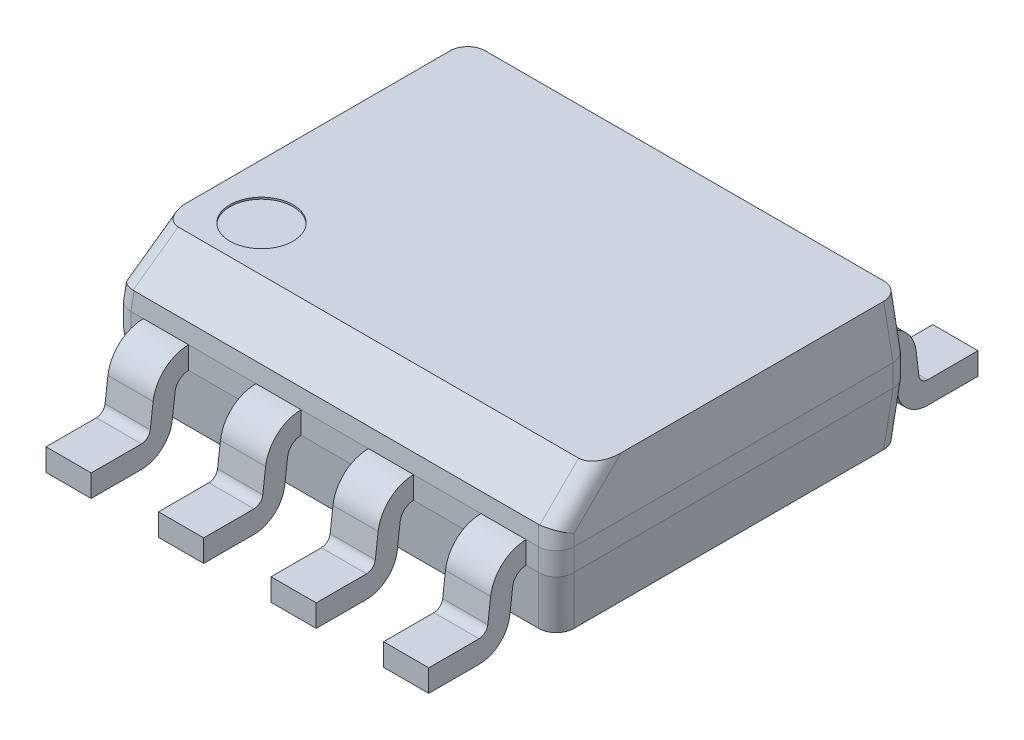
from build123d import *

# Parameters (mm, degrees)
BOSS_EXTRUDE1_DEPTH      = 0.125
BOSS_EXTRUDE1_DEPTH_BACK = 0.125
SKETCH1_W                = 5
SKETCH1_H                = 4
SKETCH2_W                = 5
SKETCH2_H                = 4
BOSS_EXTRUDE2_DEPTH      = 0.6
BOSS_EXTRUDE2_TAPER      = 5
SKETCH3_W                = 5
SKETCH3_H                = 4
BOSS_EXTRUDE3_DEPTH      = 0.6
BOSS_EXTRUDE3_TAPER      = 5
CHAMFER1_SIZE            = 0.4
CHAMFER1_SIZE2           = 0.440025147
BOSS_EXTRUDE4_START      = 0.38
BOSS_EXTRUDE4_DEPTH      = 0.51
LPATTERN1_COUNT          = 2
LPATTERN1_PITCH          = 1.27
LPATTERN1_COL_COUNT      = 3
LPATTERN1_COL_PITCH      = 1.27
SKETCH6_R                = 0.356697025
CUT_EXTRUDE1_DEPTH       = 0.02
FILLET_1_R               = 0.2
CUT_EXTRUDE2_DEPTH       = 0.01


with BuildPart() as part:
    # Sketch1 → Boss-Extrude1 (new, two sides: drawn at the far end of the back side and taken through both)
    with BuildSketch(Plane(origin=(0, 0.82, 0), x_dir=(1, 0, 0), z_dir=(0, 1, 0)).offset(-BOSS_EXTRUDE1_DEPTH_BACK)):
        Rectangle(SKETCH1_W, SKETCH1_H)
    extrude(amount=BOSS_EXTRUDE1_DEPTH + BOSS_EXTRUDE1_DEPTH_BACK)

    # Sketch2 → Boss-Extrude2 (add)
    with BuildSketch(Plane(origin=(0, 0.945, 0), x_dir=(1, 0, 0), z_dir=(0, 1, 0))):
        Rectangle(SKETCH2_W, SKETCH2_H)
    extrude(amount=BOSS_EXTRUDE2_DEPTH, taper=BOSS_EXTRUDE2_TAPER)

    # Sketch3 → Boss-Extrude3 (add)
    with BuildSketch(Plane.XZ.offset(-0.695)):
        Rectangle(SKETCH3_W, SKETCH3_H)
    extrude(amount=BOSS_EXTRUDE3_DEPTH, taper=BOSS_EXTRUDE3_TAPER)

    # Chamfer1
    chamfer1_edges = [part.edges().sort_by_distance(p)[0] for p in [
        (0, 1.545, 1.947506802),
    ]]
    chamfer1_side = [part.faces().sort_by_distance(p)[0] for p in [
        (0, 1.243938997, 1.973846227),
    ]]
    chamfer(chamfer1_edges, length=CHAMFER1_SIZE, length2=CHAMFER1_SIZE2, reference=chamfer1_side[0])

    # Sketch5 → Boss-Extrude4 (add)
    with BuildSketch(Plane(origin=(0, 0, 0), x_dir=(0, 0, -1), z_dir=(1, 0, 0)).offset(BOSS_EXTRUDE4_START)):
        with BuildLine():
            Line((2.43285762, 0.329963507), (2.400847843, 0.590403282))
            ThreePointArc((2.400847843, 0.590403282), (2.267590241, 0.843628667), (2, 0.945))
            Line((2, 0.945), (2, 0.695))
            ThreePointArc((2, 0.695), (2.101946488, 0.656379776), (2.152714971, 0.559906105))
            Line((2.152714971, 0.559906105), (2.184724748, 0.299466331))
            ThreePointArc((2.184724748, 0.299466331), (2.300209515, 0.080013931), (2.532110769, -0.007837622))
            Line((2.532110769, -0.007837622), (3.099630301, -0.007837622))
            Line((3.099630301, -0.007837622), (3.099630301, 0.242162378))
            Line((3.099630301, 0.242162378), (2.532110769, 0.242162378))
            ThreePointArc((2.532110769, 0.242162378), (2.465853268, 0.267262822), (2.43285762, 0.329963507))
        make_face()
        with BuildLine():
            ThreePointArc((-2.152714971, 0.559906105), (-2.101946488, 0.656379776), (-2, 0.695))
            Line((-2, 0.695), (-2, 0.945))
            ThreePointArc((-2, 0.945), (-2.267590241, 0.843628667), (-2.400847843, 0.590403282))
            Line((-2.400847843, 0.590403282), (-2.43285762, 0.329963507))
            ThreePointArc((-2.43285762, 0.329963507), (-2.465853268, 0.267262822), (-2.532110769, 0.242162378))
            Line((-2.532110769, 0.242162378), (-3.099630301, 0.242162378))
            Line((-3.099630301, 0.242162378), (-3.099630301, -0.007837622))
            Line((-3.099630301, -0.007837622), (-2.532110769, -0.007837622))
            ThreePointArc((-2.532110769, -0.007837622), (-2.300209515, 0.080013931), (-2.184724748, 0.299466331))
            Line((-2.184724748, 0.299466331), (-2.152714971, 0.559906105))
        make_face()
    boss_extrude4 = extrude(amount=BOSS_EXTRUDE4_DEPTH)

    # LPattern1: Boss-Extrude4 ×2
    with Locations(*[(i * LPATTERN1_PITCH, 0, 0) for i in range(1, LPATTERN1_COUNT)]):
        add(boss_extrude4)

    # LPattern1 col: Boss-Extrude4 ×3
    with Locations(*[(-i * LPATTERN1_COL_PITCH, 0, 0) for i in range(1, LPATTERN1_COL_COUNT)]):
        add(boss_extrude4)

    # Sketch6 → Cut-Extrude1 (cut)
    with BuildSketch(Plane(origin=(0, 1.545, 0), x_dir=(1, 0, 0), z_dir=(0, 1, 0))):
        with Locations(Location((-1.829466097, -0.997890598, 0), (0, 0, 270))):
            Circle(SKETCH6_R)
    extrude(amount=-CUT_EXTRUDE1_DEPTH, mode=Mode.SUBTRACT)

    # Скругление1
    fillet_1_edges = [part.edges().sort_by_distance(p)[0] for p in [
        (-2.33, 0.945, 2),
        (2.33, 0.695, -2),
        (2.33, 0.945, -2),
        (2.473753401, 1.245, -1.973753401),
        (-2.473753401, 1.245, -1.973753401),
        (2.473753401, 0.395, 1.973753401),
        (-2.473753401, 0.395, 1.973753401),
        (-2.473753401, 0.395, -1.973753401),
        (2.473753401, 0.395, -1.973753401),
        (2.491184549, 1.04576106, 1.991184549),
        (2.46493795, 1.34576106, 1.744925377),
        (-2.491184549, 1.04576106, 1.991184549),
        (-2.46493795, 1.34576106, 1.744925377),
        (-2.33, 0.695, 2),
        (-2.5, 0.82, -2),
        (2.5, 0.82, -2),
        (2.5, 0.82, 2),
        (-2.5, 0.82, 2),
    ]]
    fillet(fillet_1_edges, radius=FILLET_1_R)

    # Sketch7 → Cut-Extrude2 (cut)
    # profile 1 of 3: a face of its own
    with BuildSketch(Plane(origin=(0, 1.745, 0), x_dir=(1, 0, 0), z_dir=(0, 1, 0))):
        with BuildLine():
            Line((-1.226287299, -0.23455359), (-1.141752043, -0.1838725))
            add(Edge.make_bspline(
                [(-1.141752043, -0.1838725), (-1.133889689, -0.197033753), (-1.118825723, -0.222250206), (-1.093696763, -0.256323932), (-1.067658789, -0.285284548), (-1.040518979, -0.308963579), (-1.012442994, -0.327606118), (-0.98324755, -0.340806755), (-0.953031033, -0.349039891), (-0.932467084, -0.350039916), (-0.92220076, -0.350539167)],
                knots=[0, 0, 0, 0, 1.272034388, 2.437168799, 3.508375237, 4.49857839, 5.41946034, 6.295179144, 7.148887113, 8, 8, 8, 8], degree=3))
            add(Edge.make_bspline(
                [(-0.92220076, -0.350539167), (-0.913433086, -0.350294975), (-0.896051151, -0.349810863), (-0.870461939, -0.345159206), (-0.845609995, -0.338012883), (-0.822007527, -0.327778331), (-0.799980209, -0.315395907), (-0.78066401, -0.300439856), (-0.763965121, -0.283695226), (-0.750305374, -0.265014467), (-0.739825363, -0.244923854), (-0.731770487, -0.224302153), (-0.727300466, -0.202825419), (-0.726627108, -0.188365287), (-0.726287299, -0.181068013)],
                knots=[0, 0, 0, 0, 1.095163259, 2.171163733, 3.241058638, 4.321873601, 5.38011039, 6.391990106, 7.366004449, 8.327778327, 9.272591725, 10.192022065, 11.087607919, 12, 12, 12, 12], degree=3))
            add(Edge.make_bspline(
                [(-0.726287299, -0.181068013), (-0.726708531, -0.172742056), (-0.727564833, -0.155816602), (-0.734802399, -0.130845273), (-0.746187898, -0.10613311), (-0.75669151, -0.090847034), (-0.762144671, -0.082910962)],
                knots=[0, 0, 0, 0, 0.938893495, 1.908633276, 2.914225137, 4, 4, 4, 4], degree=3))
            add(Edge.make_bspline(
                [(-0.762144671, -0.082910962), (-0.766621989, -0.077183298), (-0.776021559, -0.065158784), (-0.792180848, -0.047260145), (-0.811142595, -0.02879774), (-0.832257897, -0.009066581), (-0.856295922, 0.011015647), (-0.882503783, 0.032406583), (-0.9115506, 0.054292748), (-0.931921885, 0.068970624), (-0.942433132, 0.076544166)],
                knots=[0, 0, 0, 0, 0.722233717, 1.516239348, 2.393582979, 3.351407094, 4.387010283, 5.505090956, 6.712668013, 8, 8, 8, 8], degree=3))
            add(Edge.make_bspline(
                [(-0.942433132, 0.076544166), (-0.952954274, 0.084038048), (-0.973069896, 0.098365781), (-1.001200919, 0.119629862), (-1.02635648, 0.139070967), (-1.048424771, 0.156872114), (-1.067396084, 0.173035715), (-1.083419916, 0.187406555), (-1.096088075, 0.200373286), (-1.103132527, 0.208785098), (-1.106295312, 0.212561794)],
                knots=[0, 0, 0, 0, 1.452282411, 2.77665338, 3.964542531, 5.026858415, 5.96415736, 6.766646006, 7.446254459, 8, 8, 8, 8], degree=3))
            add(Edge.make_bspline(
                [(-1.106295312, 0.212561794), (-1.110716039, 0.218447805), (-1.119409992, 0.230023435), (-1.130885994, 0.248116251), (-1.14064004, 0.266637184), (-1.148286421, 0.285636003), (-1.154725341, 0.304845982), (-1.159056178, 0.324517767), (-1.161768006, 0.344563086), (-1.162045716, 0.358052658), (-1.162184735, 0.364805384)],
                knots=[0, 0, 0, 0, 1.068054152, 2.10047183, 3.106115577, 4.101338837, 5.06977816, 6.043150881, 7.020423561, 8, 8, 8, 8], degree=3))
            add(Edge.make_bspline(
                [(-1.162184735, 0.364805384), (-1.161811818, 0.37538532), (-1.161073955, 0.396319052), (-1.154833807, 0.42689929), (-1.144984409, 0.456095409), (-1.13118587, 0.483618361), (-1.113398055, 0.508751499), (-1.092813491, 0.531783924), (-1.068295923, 0.551146376), (-1.041395174, 0.568064107), (-1.011950496, 0.581305799), (-0.981095952, 0.591294651), (-0.948782503, 0.596954439), (-0.926895893, 0.597766657), (-0.915790504, 0.598178782)],
                knots=[0, 0, 0, 0, 1.005424448, 1.989358655, 2.955360095, 3.929531133, 4.905563448, 5.876582895, 6.856512386, 7.866279853, 8.892233794, 9.918561126, 10.94386622, 12, 12, 12, 12], degree=3))
            add(Edge.make_bspline(
                [(-0.915790504, 0.598178782), (-0.904006475, 0.597772338), (-0.880571803, 0.596964052), (-0.846100599, 0.589936186), (-0.812911823, 0.578307423), (-0.786213747, 0.565110663), (-0.765318673, 0.551930259), (-0.749383606, 0.539924595), (-0.733235763, 0.526103135), (-0.71674489, 0.510429065), (-0.700190416, 0.492758565), (-0.683326573, 0.473212654), (-0.666113924, 0.45191078), (-0.655040821, 0.43670378), (-0.649364222, 0.428907948)],
                knots=[0, 0, 0, 0, 1.286793592, 2.559021753, 3.825965368, 5.121522368, 5.803751409, 6.523245864, 7.299691795, 8.125521123, 9.008227632, 9.944561021, 10.946284179, 12, 12, 12, 12], degree=3))
            Line((-0.649364222, 0.428907948), (-0.73049403, 0.367409551))
            add(Edge.make_bspline(
                [(-0.73049403, 0.367409551), (-0.735392868, 0.373720605), (-0.744826884, 0.38587422), (-0.759149594, 0.402894596), (-0.772649208, 0.418442162), (-0.785949322, 0.431946484), (-0.798347503, 0.444147094), (-0.810380943, 0.454592739), (-0.821876472, 0.463385766), (-0.836367018, 0.47276964), (-0.854572081, 0.482071498), (-0.877424805, 0.489942663), (-0.901306598, 0.494672681), (-0.917572207, 0.495298078), (-0.92580653, 0.495614679)],
                knots=[0, 0, 0, 0, 1.181633172, 2.275549214, 3.290209073, 4.226197932, 5.078386478, 5.862611352, 6.581680152, 7.217281963, 8.414376989, 9.595101626, 10.782541182, 12, 12, 12, 12], degree=3))
            add(Edge.make_bspline(
                [(-0.92580653, 0.495614679), (-0.936136965, 0.495268479), (-0.956058235, 0.494600865), (-0.98434116, 0.487309441), (-1.009796567, 0.475828909), (-1.031668729, 0.459738915), (-1.049879293, 0.440675775), (-1.063052282, 0.418738959), (-1.0709809, 0.394515415), (-1.071948409, 0.377617799), (-1.072441145, 0.369012115)],
                knots=[0, 0, 0, 0, 1.14458467, 2.207223713, 3.21896685, 4.227309161, 5.202851033, 6.127160689, 7.046193047, 8, 8, 8, 8], degree=3))
            add(Edge.make_bspline(
                [(-1.072441145, 0.369012115), (-1.072328823, 0.36365455), (-1.072103996, 0.352930658), (-1.068968339, 0.337087395), (-1.06493996, 0.321284155), (-1.05855635, 0.305591989), (-1.049743407, 0.289736457), (-1.038170499, 0.273444532), (-1.023595267, 0.256572616), (-1.012430406, 0.24559908), (-1.006535696, 0.239805384)],
                knots=[0, 0, 0, 0, 0.858281714, 1.717966888, 2.583508476, 3.4729293, 4.427298488, 5.488583878, 6.674047936, 8, 8, 8, 8], degree=3))
            add(Edge.make_bspline(
                [(-1.006535696, 0.239805384), (-1.004346733, 0.237851948), (-0.999146256, 0.233211032), (-0.989638849, 0.225613237), (-0.977083764, 0.216241016), (-0.961808849, 0.20464464), (-0.94353246, 0.191192794), (-0.922252587, 0.176057476), (-0.898206435, 0.158747345), (-0.88114303, 0.146645191), (-0.872120632, 0.140246089)],
                knots=[0, 0, 0, 0, 0.420754252, 0.999615792, 1.744751191, 2.668019286, 3.750313428, 4.999500688, 6.413464383, 8, 8, 8, 8], degree=3))
            add(Edge.make_bspline(
                [(-0.872120632, 0.140246089), (-0.861267514, 0.132348558), (-0.840251955, 0.117056083), (-0.81034979, 0.094080175), (-0.783237273, 0.071609384), (-0.758819215, 0.04978721), (-0.736854384, 0.028779184), (-0.717586464, 0.008332561), (-0.700819126, -0.011406174), (-0.682767921, -0.036712625), (-0.66432283, -0.067792934), (-0.648482399, -0.105872431), (-0.6384943, -0.144099951), (-0.637188153, -0.169793333), (-0.636543709, -0.182470257)],
                knots=[0, 0, 0, 0, 1.163667725, 2.253281268, 3.268753668, 4.215851969, 5.092017293, 5.902905408, 6.650798638, 7.335211899, 8.59617414, 9.77448103, 10.901945474, 12, 12, 12, 12], degree=3))
            add(Edge.make_bspline(
                [(-0.636543709, -0.182470257), (-0.636731463, -0.191435504), (-0.637103324, -0.209191899), (-0.641377871, -0.235264778), (-0.647640633, -0.260587884), (-0.657079842, -0.284848202), (-0.668600745, -0.308489563), (-0.683219673, -0.33089182), (-0.700164725, -0.352550791), (-0.719602944, -0.372888931), (-0.740873202, -0.391559273), (-0.763354257, -0.408167576), (-0.787082907, -0.422015669), (-0.811930426, -0.433315909), (-0.837902522, -0.442154057), (-0.86499046, -0.448557734), (-0.893238892, -0.452487937), (-0.91243903, -0.452895869), (-0.92220076, -0.45310327)],
                knots=[0, 0, 0, 0, 0.983748083, 1.948392443, 2.894712957, 3.844097841, 4.80183111, 5.778335162, 6.776009319, 7.81870978, 8.863265674, 9.881300176, 10.883814829, 11.87499822, 12.874611388, 13.892143829, 14.928324115, 16, 16, 16, 16], degree=3))
            add(Edge.make_bspline(
                [(-0.92220076, -0.45310327), (-0.929753716, -0.452957218), (-0.944764504, -0.452666953), (-0.966967213, -0.450100873), (-0.988721382, -0.446470272), (-1.009754034, -0.440706252), (-1.030336151, -0.43371283), (-1.050378218, -0.425101878), (-1.069889948, -0.414782678), (-1.088980686, -0.402984099), (-1.107601879, -0.389253315), (-1.125578869, -0.373260887), (-1.143501494, -0.355447886), (-1.16084075, -0.335330582), (-1.177947363, -0.313233987), (-1.194484051, -0.288951363), (-1.210793113, -0.262614976), (-1.221026104, -0.244082095), (-1.226287299, -0.23455359)],
                knots=[0, 0, 0, 0, 0.915332311, 1.819136955, 2.706846663, 3.586547465, 4.459518054, 5.340707479, 6.227863349, 7.133153174, 8.059268498, 9.028702269, 10.047606654, 11.120612155, 12.245963614, 13.433783089, 14.680604001, 16, 16, 16, 16], degree=3))
        make_face()
    # profile 2 of 3: a face of its own
    with BuildSketch(Plane(origin=(0, 1.745, 0), x_dir=(1, 0, 0), z_dir=(0, 1, 0))):
        with BuildLine():
            add(Edge.make_bspline(
                [(0.036533214, 0.598178782), (0.055049816, 0.597709788), (0.091417949, 0.596788644), (0.14486792, 0.589737472), (0.19589509, 0.577538789), (0.24491513, 0.561292223), (0.291341694, 0.539619541), (0.335524235, 0.513423784), (0.377357627, 0.482430511), (0.416278022, 0.446879303), (0.451894294, 0.408198316), (0.483273118, 0.366918913), (0.509570917, 0.323290684), (0.531166856, 0.277444732), (0.548109316, 0.229484741), (0.559800471, 0.179155026), (0.567268514, 0.126781686), (0.568141593, 0.091059725), (0.568584496, 0.072938397)],
                knots=[0, 0, 0, 0, 1.065120563, 2.091984664, 3.0946048, 4.079830382, 5.057816894, 6.036188127, 7.030412546, 8.04752943, 9.064399622, 10.05169764, 11.02544977, 11.989514704, 12.962713494, 13.945757189, 14.957906945, 16, 16, 16, 16], degree=3))
            add(Edge.make_bspline(
                [(0.568584496, 0.072938397), (0.568141658, 0.054950555), (0.567268773, 0.019494435), (0.55979198, -0.032546549), (0.54806598, -0.082572462), (0.531324189, -0.130499792), (0.509831196, -0.176379096), (0.48335829, -0.220089654), (0.452175086, -0.261645796), (0.416687415, -0.300592272), (0.378001403, -0.336305835), (0.336507041, -0.367425514), (0.293137521, -0.394203835), (0.247334747, -0.415570599), (0.199706165, -0.432648291), (0.149825501, -0.444291899), (0.097926486, -0.451802483), (0.062534771, -0.452664916), (0.044546034, -0.45310327)],
                knots=[0, 0, 0, 0, 1.043624062, 2.057103931, 3.04512605, 4.022047818, 4.998200453, 5.980619268, 6.982898556, 8.009068085, 9.034988726, 10.034168286, 11.015286542, 11.987931943, 12.962482838, 13.94673481, 14.956375938, 16, 16, 16, 16], degree=3))
            add(Edge.make_bspline(
                [(0.044546034, -0.45310327), (0.0264248, -0.452660588), (-0.009296976, -0.451787944), (-0.061736129, -0.444307542), (-0.112101198, -0.432610027), (-0.160248156, -0.415893045), (-0.20620385, -0.394288122), (-0.250058159, -0.367944014), (-0.291635058, -0.336684831), (-0.330589843, -0.301208666), (-0.366232471, -0.262588223), (-0.397306579, -0.221207007), (-0.423656611, -0.177876877), (-0.445188992, -0.132477584), (-0.46223598, -0.085228601), (-0.473865928, -0.03581475), (-0.481390486, 0.015482252), (-0.482257585, 0.050408794), (-0.482697555, 0.068130705)],
                knots=[0, 0, 0, 0, 1.053102029, 2.075944431, 3.073151272, 4.055350789, 5.033113405, 6.020478099, 7.024410459, 8.052272461, 9.079885166, 10.07527673, 11.055994387, 12.023226415, 12.992069828, 13.970394897, 14.97016774, 16, 16, 16, 16], degree=3))
            add(Edge.make_bspline(
                [(-0.482697555, 0.068130705), (-0.482544802, 0.080025753), (-0.482241223, 0.103665788), (-0.478586454, 0.138770531), (-0.473283111, 0.173310719), (-0.465682564, 0.207188133), (-0.455742088, 0.240319843), (-0.444012937, 0.272934346), (-0.429687267, 0.304701125), (-0.413492797, 0.335770665), (-0.395417994, 0.365658638), (-0.375453494, 0.393909948), (-0.354300532, 0.420761661), (-0.331110991, 0.445517948), (-0.306649149, 0.468898993), (-0.280518184, 0.490545483), (-0.252877543, 0.510652612), (-0.223608292, 0.528772709), (-0.193431642, 0.545161034), (-0.162323991, 0.55922442), (-0.130707828, 0.571294723), (-0.098435071, 0.581077816), (-0.065591422, 0.588801255), (-0.032105198, 0.594060499), (0.001996924, 0.597724589), (0.024971587, 0.598026733), (0.036533214, 0.598178782)],
                knots=[0, 0, 0, 0, 1.037015668, 2.060948919, 3.074880161, 4.083647147, 5.086022904, 6.090072063, 7.104153813, 8.122640571, 9.144368836, 10.147691507, 11.138137339, 12.123020368, 13.103399296, 14.087645067, 15.080126199, 16.082011238, 17.087798457, 18.072939717, 19.057185487, 20.037253025, 21.01195951, 21.997135196, 22.992090687, 24, 24, 24, 24], degree=3))
        make_face()
        with BuildLine():
            add(Edge.make_bspline(
                [(0.040940265, 0.495614679), (0.03145037, 0.495498996), (0.012561303, 0.495268736), (-0.015519993, 0.492235675), (-0.043231974, 0.487912849), (-0.070580363, 0.4817467), (-0.097450731, 0.473345542), (-0.124093543, 0.463676712), (-0.150265844, 0.451899257), (-0.175881232, 0.43859277), (-0.200714111, 0.423864507), (-0.224146311, 0.407586859), (-0.246238495, 0.390141558), (-0.266936571, 0.37148789), (-0.286179764, 0.351530861), (-0.304346821, 0.330573022), (-0.320709559, 0.308015339), (-0.335705438, 0.284469509), (-0.349124821, 0.2599662), (-0.361057779, 0.234763382), (-0.370818925, 0.208655471), (-0.378779604, 0.181925712), (-0.385379549, 0.154616438), (-0.389560671, 0.126520481), (-0.392627059, 0.097779021), (-0.392844158, 0.078355634), (-0.392953966, 0.068531346)],
                knots=[0, 0, 0, 0, 1.008559885, 2.007477868, 2.99961109, 3.989939068, 4.984837346, 5.991145699, 7.001802488, 8.033829008, 9.059044045, 10.069351652, 11.065060232, 12.050310815, 13.029377138, 14.011219647, 14.996725999, 15.989392538, 16.977580475, 17.965360261, 18.951710183, 19.937753436, 20.929683414, 21.935841486, 22.955955122, 24, 24, 24, 24], degree=3))
            add(Edge.make_bspline(
                [(-0.392953966, 0.068531346), (-0.392589719, 0.054084997), (-0.391873134, 0.02566456), (-0.385599543, -0.015983481), (-0.375936121, -0.056008706), (-0.36169116, -0.094192109), (-0.343876698, -0.130861904), (-0.321869015, -0.165692791), (-0.295794991, -0.198694184), (-0.26617684, -0.229635689), (-0.233798924, -0.257877347), (-0.199418144, -0.282666893), (-0.163402828, -0.30364125), (-0.125659056, -0.320728413), (-0.08638833, -0.334268338), (-0.045337601, -0.343547947), (-0.002780327, -0.34965522), (0.026228431, -0.350241722), (0.040940265, -0.350539167)],
                knots=[0, 0, 0, 0, 1.032063989, 2.030389145, 3.003944642, 3.970395727, 4.937377036, 5.913328081, 6.909231446, 7.93887556, 8.970685674, 9.976071282, 10.964166581, 11.944589148, 12.933237628, 13.927779006, 14.949070134, 16, 16, 16, 16], degree=3))
            add(Edge.make_bspline(
                [(0.040940265, -0.350539167), (0.050828694, -0.350403309), (0.070440419, -0.350133861), (0.099610568, -0.347419953), (0.1282552, -0.34306799), (0.156334137, -0.336802089), (0.183815512, -0.32896003), (0.210814027, -0.319643536), (0.23704211, -0.308020335), (0.262830635, -0.295178063), (0.287515276, -0.280538018), (0.311079713, -0.264812832), (0.332929993, -0.247393227), (0.353612585, -0.229016709), (0.372934782, -0.209312752), (0.39076592, -0.188306975), (0.407045958, -0.165866787), (0.422036143, -0.142356671), (0.435408504, -0.117786313), (0.447059675, -0.092492119), (0.456944279, -0.066536374), (0.464923852, -0.039881639), (0.471176841, -0.012578539), (0.47548539, 0.015409483), (0.478499229, 0.044026438), (0.478726394, 0.063381825), (0.478840906, 0.073138718)],
                knots=[0, 0, 0, 0, 1.047197238, 2.076906641, 3.100256066, 4.114471768, 5.12198147, 6.126382909, 7.136867548, 8.15857795, 9.17633901, 10.174870724, 11.156907918, 12.133735059, 13.104061851, 14.077631395, 15.04955518, 16.038496417, 17.029181396, 18.010275684, 18.986308667, 19.968651475, 20.955262928, 21.950658345, 22.966943676, 24, 24, 24, 24], degree=3))
            add(Edge.make_bspline(
                [(0.478840906, 0.073138718), (0.478726302, 0.082828862), (0.478498965, 0.102051047), (0.475486829, 0.130468424), (0.471172289, 0.158255056), (0.464954373, 0.185301857), (0.456940043, 0.211615721), (0.447057949, 0.237171935), (0.435405006, 0.262065705), (0.422031227, 0.286235504), (0.406998135, 0.309428286), (0.390571208, 0.331600404), (0.372466823, 0.352335473), (0.353202245, 0.372145386), (0.332296277, 0.39060764), (0.309843622, 0.40772836), (0.286116857, 0.423920724), (0.26099479, 0.438528027), (0.235067946, 0.452017808), (0.208463958, 0.463575238), (0.181484215, 0.473395843), (0.154197326, 0.481772119), (0.126373618, 0.487888699), (0.098201095, 0.49223957), (0.069718736, 0.495267681), (0.05056353, 0.495498646), (0.040940265, 0.495614679)],
                knots=[0, 0, 0, 0, 1.02996197, 2.043119294, 3.035359645, 4.018872909, 4.991431989, 5.957985074, 6.929999688, 7.912076566, 8.892894881, 9.867085534, 10.843653904, 11.817741046, 12.803660682, 13.806313499, 14.818574707, 15.856120519, 16.894564902, 17.924820532, 18.937903209, 19.946497019, 20.957711757, 21.963978472, 22.977135795, 24, 24, 24, 24], degree=3))
        make_face(mode=Mode.SUBTRACT)
    # profile 3 of 3: a face of its own
    with BuildSketch(Plane(origin=(0, 1.745, 0), x_dir=(1, 0, 0), z_dir=(0, 1, 0))):
        with BuildLine():
            add(Edge.make_bspline(
                [(1.170146996, 0.129629102), (1.178332295, 0.125361115), (1.194296362, 0.117037114), (1.217032707, 0.10363402), (1.237811279, 0.08950803), (1.257208583, 0.075326356), (1.274883826, 0.060545884), (1.290639372, 0.04510784), (1.304864406, 0.02939757), (1.317272059, 0.013149044), (1.328185441, -0.00359457), (1.33761748, -0.02087722), (1.345679537, -0.038661029), (1.352068949, -0.057140123), (1.357332318, -0.076043055), (1.360953919, -0.095613907), (1.36290161, -0.115723719), (1.363269842, -0.129314662), (1.363456291, -0.136196218)],
                knots=[0, 0, 0, 0, 1.272397273, 2.481599622, 3.635517121, 4.734568067, 5.792894095, 6.808321871, 7.773003508, 8.711915296, 9.623354172, 10.525449501, 11.423591555, 12.311487226, 13.218079475, 14.126165749, 15.051214107, 16, 16, 16, 16], degree=3))
            add(Edge.make_bspline(
                [(1.363456291, -0.136196218), (1.363235885, -0.145824142), (1.362799619, -0.164881415), (1.358999624, -0.193008876), (1.353310201, -0.220326528), (1.345001769, -0.246828382), (1.334226515, -0.272368203), (1.320947419, -0.296967853), (1.305915646, -0.321030513), (1.293843577, -0.335836056), (1.287735137, -0.343327629)],
                knots=[0, 0, 0, 0, 1.025265484, 2.029385089, 3.018602448, 3.995076438, 4.983346944, 5.966715145, 6.97116228, 8, 8, 8, 8], degree=3))
            add(Edge.make_bspline(
                [(1.287735137, -0.343327629), (1.279781859, -0.352068707), (1.263973583, -0.369442848), (1.236892746, -0.392000222), (1.207172208, -0.410957192), (1.17492697, -0.426406304), (1.140243227, -0.438430836), (1.103128368, -0.447071555), (1.063510039, -0.45202082), (1.036279904, -0.452736246), (1.022310457, -0.45310327)],
                knots=[0, 0, 0, 0, 0.954267603, 1.896743057, 2.838368354, 3.796610408, 4.779680527, 5.799409237, 6.871065594, 8, 8, 8, 8], degree=3))
            add(Edge.make_bspline(
                [(1.022310457, -0.45310327), (1.008878061, -0.45277399), (0.982739981, -0.452133246), (0.944694873, -0.44779198), (0.909231139, -0.440184018), (0.876142577, -0.429771272), (0.845628664, -0.416225493), (0.81777635, -0.399365947), (0.792183786, -0.37987125), (0.769627651, -0.357181513), (0.749602381, -0.332879264), (0.732011509, -0.307807375), (0.717390343, -0.281963559), (0.705011173, -0.255733168), (0.695534595, -0.228748553), (0.688971107, -0.201148549), (0.684802731, -0.172981365), (0.684248121, -0.153972322), (0.683969111, -0.144409359)],
                knots=[0, 0, 0, 0, 1.256902934, 2.445805442, 3.576955095, 4.645999104, 5.686449165, 6.692658513, 7.68621702, 8.689161843, 9.678783111, 10.630372946, 11.551080876, 12.453998257, 13.34127905, 14.221779781, 15.105423033, 16, 16, 16, 16], degree=3))
            add(Edge.make_bspline(
                [(0.683969111, -0.144409359), (0.68413422, -0.137392447), (0.684460534, -0.123524553), (0.686719062, -0.103036173), (0.690350051, -0.08309442), (0.695281324, -0.063625636), (0.701964474, -0.044771558), (0.710033655, -0.026442852), (0.719442785, -0.008618823), (0.730323117, 0.008798), (0.742980839, 0.025563575), (0.75731331, 0.04196243), (0.773606987, 0.057740107), (0.791680604, 0.073089371), (0.811327615, 0.088282506), (0.833058338, 0.102498429), (0.8562967, 0.116743561), (0.87281253, 0.125260226), (0.881284816, 0.129629102)],
                knots=[0, 0, 0, 0, 0.941657376, 1.861047343, 2.762797495, 3.66048619, 4.553285746, 5.444104102, 6.34607688, 7.256116206, 8.197091036, 9.162375105, 10.176350973, 11.237807142, 12.343728897, 13.50695164, 14.721116704, 16, 16, 16, 16], degree=3))
            add(Edge.make_bspline(
                [(0.881284816, 0.129629102), (0.869687281, 0.135953322), (0.847231206, 0.148198781), (0.81749708, 0.170697869), (0.791956902, 0.195065816), (0.771312697, 0.221817186), (0.755063489, 0.250116293), (0.743915316, 0.279786079), (0.736373463, 0.310276397), (0.73562637, 0.331106739), (0.735251163, 0.341568205)],
                knots=[0, 0, 0, 0, 1.166880483, 2.259407225, 3.286803203, 4.280235371, 5.237608625, 6.161067461, 7.076446754, 8, 8, 8, 8], degree=3))
            add(Edge.make_bspline(
                [(0.735251163, 0.341568205), (0.735718427, 0.35222465), (0.736657709, 0.373645963), (0.744252943, 0.405533427), (0.756630105, 0.436852446), (0.773464676, 0.467451221), (0.794432452, 0.496294139), (0.819588608, 0.522162981), (0.848332407, 0.544823405), (0.880520369, 0.563845168), (0.915159293, 0.579326214), (0.951706643, 0.590005763), (0.989525641, 0.596987511), (1.015267847, 0.597777983), (1.028320073, 0.598178782)],
                knots=[0, 0, 0, 0, 0.888701115, 1.786444228, 2.72001202, 3.692817113, 4.693886446, 5.687152267, 6.695133018, 7.739871481, 8.800368666, 9.853104506, 10.91144658, 12, 12, 12, 12], degree=3))
            add(Edge.make_bspline(
                [(1.028320073, 0.598178782), (1.041035449, 0.597765541), (1.066108721, 0.596950677), (1.102964329, 0.590154426), (1.138228579, 0.578803135), (1.171779865, 0.563403928), (1.203017541, 0.544436231), (1.230618201, 0.521464552), (1.254998939, 0.495709823), (1.275165909, 0.466875651), (1.291783877, 0.436394453), (1.303355563, 0.404502304), (1.310770413, 0.371888287), (1.31170566, 0.349820286), (1.31217424, 0.338763718)],
                knots=[0, 0, 0, 0, 1.072916533, 2.115669174, 3.151510826, 4.193348718, 5.225979165, 6.227137561, 7.216255879, 8.211077061, 9.189680878, 10.138522389, 11.067357538, 12, 12, 12, 12], degree=3))
            add(Edge.make_bspline(
                [(1.31217424, 0.338763718), (1.311764365, 0.327913242), (1.310959395, 0.306603525), (1.304187984, 0.275538805), (1.29278418, 0.246446794), (1.277214419, 0.218997379), (1.256921422, 0.19368838), (1.23217607, 0.17019796), (1.203175648, 0.148333152), (1.181386823, 0.13599419), (1.170146996, 0.129629102)],
                knots=[0, 0, 0, 0, 0.975232327, 1.915300861, 2.843280834, 3.77672583, 4.742871857, 5.749627742, 6.839139064, 8, 8, 8, 8], degree=3))
        make_face()
        with BuildLine():
            add(Edge.make_bspline(
                [(1.02331206, 0.495614679), (1.016297544, 0.495428553), (1.002574084, 0.49506441), (0.982451606, 0.493161942), (0.963316644, 0.489461023), (0.944969273, 0.484535677), (0.927661041, 0.477881966), (0.911156882, 0.47005482), (0.895737685, 0.460538802), (0.881217313, 0.449864174), (0.868145663, 0.438123343), (0.856544362, 0.425890852), (0.846907758, 0.412926454), (0.838724584, 0.399552637), (0.832787008, 0.385372473), (0.828340064, 0.370820708), (0.825333952, 0.355713455), (0.825108698, 0.345388738), (0.824994752, 0.340165961)],
                knots=[0, 0, 0, 0, 1.203892937, 2.355340988, 3.463153438, 4.544400666, 5.610487187, 6.640501085, 7.674077295, 8.714426146, 9.728707835, 10.68524104, 11.601827946, 12.495867327, 13.368432065, 14.231010473, 15.105153427, 16, 16, 16, 16], degree=3))
            add(Edge.make_bspline(
                [(0.824994752, 0.340165961), (0.825191143, 0.334942958), (0.825579239, 0.324621555), (0.828580704, 0.309379879), (0.833054091, 0.294402268), (0.840097137, 0.280044865), (0.848544668, 0.26580962), (0.858970804, 0.252052309), (0.871396241, 0.238725056), (0.885404081, 0.225941216), (0.90066452, 0.213970141), (0.91683139, 0.203577803), (0.933701787, 0.194882343), (0.951102378, 0.18764537), (0.969210506, 0.182019674), (0.987915213, 0.178028632), (1.007219642, 0.175548062), (1.020299808, 0.17525177), (1.026917829, 0.175101859)],
                knots=[0, 0, 0, 0, 0.873023192, 1.725219244, 2.590779336, 3.480155217, 4.391973325, 5.357036234, 6.360879153, 7.436073238, 8.526419356, 9.601555421, 10.645666583, 11.697338044, 12.750135903, 13.812665442, 14.89329948, 16, 16, 16, 16], degree=3))
            add(Edge.make_bspline(
                [(1.026917829, 0.175101859), (1.035417859, 0.175351249), (1.052333964, 0.175847567), (1.077270916, 0.180462188), (1.101517386, 0.187721022), (1.124814216, 0.197652441), (1.146558383, 0.210117544), (1.165941259, 0.225041263), (1.182797514, 0.242079005), (1.196951975, 0.26096553), (1.207926216, 0.281065983), (1.21646959, 0.301237496), (1.221458509, 0.321695276), (1.222109242, 0.335400123), (1.22243065, 0.342169166)],
                knots=[0, 0, 0, 0, 1.076279235, 2.141928126, 3.20205304, 4.278698113, 5.344010996, 6.36967002, 7.368914609, 8.37248503, 9.349703398, 10.264243087, 11.142681841, 12, 12, 12, 12], degree=3))
            add(Edge.make_bspline(
                [(1.22243065, 0.342169166), (1.222278679, 0.346920034), (1.221977039, 0.356349825), (1.219491309, 0.370275072), (1.215383928, 0.383883524), (1.209823048, 0.397287602), (1.202505964, 0.410299239), (1.193830481, 0.423122979), (1.183292052, 0.43547034), (1.1714645, 0.447629068), (1.158051526, 0.458881646), (1.14307898, 0.468777278), (1.126623623, 0.477180808), (1.108685065, 0.484006167), (1.089329373, 0.489132552), (1.068645694, 0.492971509), (1.046461567, 0.495135255), (1.031195924, 0.495451405), (1.02331206, 0.495614679)],
                knots=[0, 0, 0, 0, 0.814439003, 1.616544685, 2.417341072, 3.248991801, 4.09997495, 4.973547432, 5.9003056, 6.880240646, 7.880314356, 8.896779544, 9.951930927, 11.043077905, 12.18215768, 13.381699519, 14.647792085, 16, 16, 16, 16], degree=3))
        make_face(mode=Mode.SUBTRACT)
        with BuildLine():
            add(Edge.make_bspline(
                [(1.029121355, 0.072537756), (1.020228273, 0.072379573), (1.002782217, 0.072069256), (0.977223095, 0.068615113), (0.952693619, 0.063806715), (0.929276494, 0.05651219), (0.90698161, 0.047027478), (0.885688272, 0.035617609), (0.865559377, 0.02213034), (0.846872884, 0.006737021), (0.829809076, -0.009851394), (0.814838133, -0.027412004), (0.802124556, -0.045618442), (0.791886484, -0.064701936), (0.783483132, -0.084258396), (0.777964881, -0.104774852), (0.774427249, -0.125856885), (0.773952212, -0.140188341), (0.773712701, -0.147414167)],
                knots=[0, 0, 0, 0, 1.140299081, 2.23698856, 3.303958914, 4.344563908, 5.37730929, 6.408454204, 7.439741482, 8.480804886, 9.510774543, 10.48932336, 11.43758569, 12.353841022, 13.263987381, 14.161954604, 15.073269652, 16, 16, 16, 16], degree=3))
            add(Edge.make_bspline(
                [(0.773712701, -0.147414167), (0.774102204, -0.156394426), (0.774874967, -0.17421105), (0.781005436, -0.200543356), (0.79084416, -0.226035086), (0.80456565, -0.250478501), (0.821556385, -0.273321388), (0.842449662, -0.293232467), (0.865947044, -0.310924318), (0.892843574, -0.325233042), (0.922223136, -0.336660143), (0.954077915, -0.344533276), (0.987950749, -0.349745118), (1.011339204, -0.350270313), (1.02331206, -0.350539167)],
                knots=[0, 0, 0, 0, 0.898778495, 1.783155532, 2.693654817, 3.627872908, 4.583023416, 5.533784346, 6.509005473, 7.520592997, 8.575161974, 9.658835044, 10.801527049, 12, 12, 12, 12], degree=3))
            add(Edge.make_bspline(
                [(1.02331206, -0.350539167), (1.032669308, -0.350359508), (1.050900228, -0.350009473), (1.077496213, -0.346919675), (1.102594656, -0.342019782), (1.126146884, -0.334893055), (1.148416552, -0.326193061), (1.169026082, -0.315001038), (1.188505661, -0.302271803), (1.20589541, -0.287169472), (1.22173347, -0.271032474), (1.235542982, -0.253949604), (1.247530854, -0.236385138), (1.256939699, -0.217942142), (1.264461485, -0.198974453), (1.269868215, -0.179307164), (1.273204277, -0.158879954), (1.273541676, -0.145023077), (1.273712701, -0.137999103)],
                knots=[0, 0, 0, 0, 1.224942928, 2.386581632, 3.501229538, 4.569074225, 5.605009692, 6.626002462, 7.634866581, 8.645888296, 9.63523824, 10.59253846, 11.518950513, 12.414518923, 13.29783783, 14.186679152, 15.080837789, 16, 16, 16, 16], degree=3))
            add(Edge.make_bspline(
                [(1.273712701, -0.137999103), (1.273453887, -0.131177006), (1.272943551, -0.117725021), (1.269704497, -0.097791728), (1.264014246, -0.078533781), (1.256206419, -0.059719494), (1.245811858, -0.041730079), (1.233570466, -0.024096888), (1.218800718, -0.007309332), (1.202111405, 0.008762981), (1.18392313, 0.02362462), (1.16458966, 0.036771603), (1.144259814, 0.047843636), (1.122976611, 0.056848349), (1.100787309, 0.063930483), (1.07770823, 0.06887791), (1.053712351, 0.071992083), (1.03741096, 0.07235381), (1.029121355, 0.072537756)],
                knots=[0, 0, 0, 0, 0.917430815, 1.809013306, 2.70690318, 3.612392954, 4.541220862, 5.495268465, 6.494511384, 7.542276156, 8.608045339, 9.649016899, 10.681629292, 11.715607085, 12.752076957, 13.808767841, 14.885711793, 16, 16, 16, 16], degree=3))
        make_face(mode=Mode.SUBTRACT)
    extrude(amount=-CUT_EXTRUDE2_DEPTH, mode=Mode.SUBTRACT)


solid = part.part
